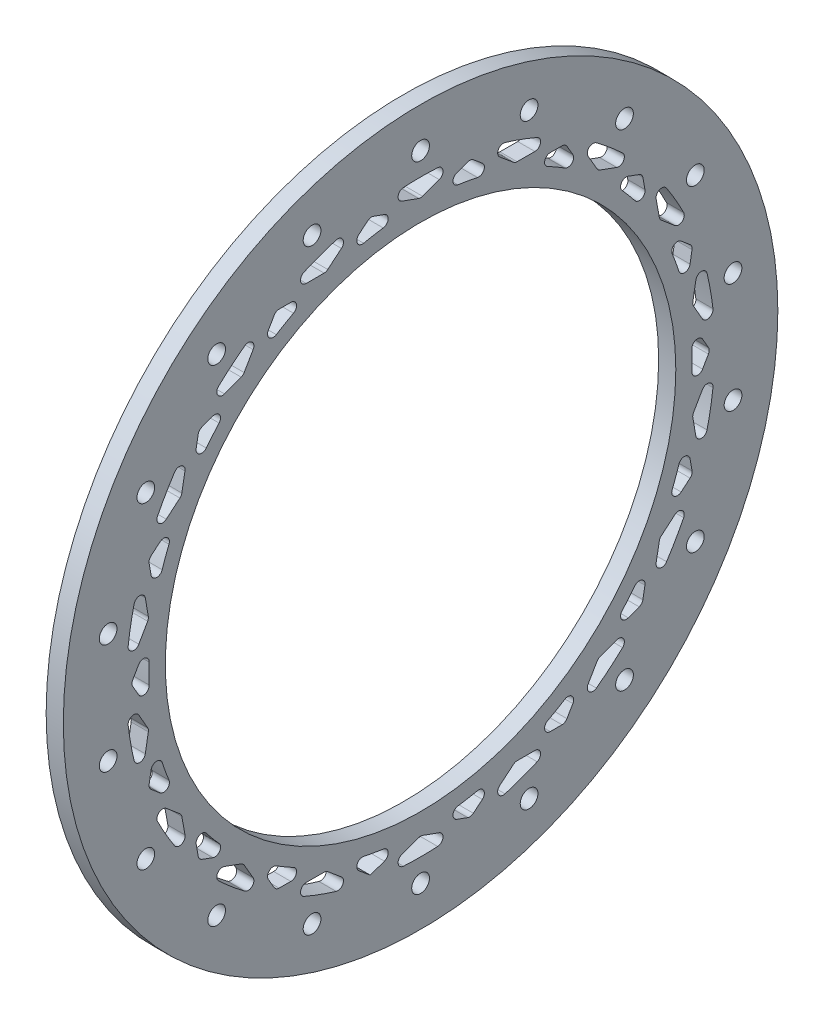
from build123d import *

# Parameters (mm, degrees)
SKETCH_1_R               = 62.5
SKETCH_1_R_2             = 44.65
EXTRUDE_1_DEPTH          = 3
SKETCH_2_R               = 1.55
CUT_EXTRUDE_1_DEPTH      = 89.439244682
PATTERN_CIRCULAR_1_COUNT = 18
SKETCH_3_R               = 51.5
SKETCH_3_R_2             = 47.5
CUT_EXTRUDE_2_DEPTH      = 89.439244682
EXTRUDE_4_DEPTH          = 3
FILLET_1_R               = 1


with BuildPart() as part:
    # 草图1 → 凸台-拉伸1 (new body)
    with BuildSketch(Plane(origin=(0, 0, 0), x_dir=(0, 0, -1), z_dir=(1, 0, 0))):
        Circle(SKETCH_1_R)
        Circle(SKETCH_1_R_2, mode=Mode.SUBTRACT)
    extrude(amount=EXTRUDE_1_DEPTH)

    # 草图2 → 切除-拉伸1 (cut, through all)
    with BuildSketch(Plane(origin=(3, 0, 0), x_dir=(0, 0, -1), z_dir=(1, 0, 0))):
        with Locations((0, 55.5)):
            Circle(SKETCH_2_R)
    cut_extrude_1 = extrude(amount=-CUT_EXTRUDE_1_DEPTH, mode=Mode.SUBTRACT)

    # 阵列(圆周)1: 切除-拉伸1 ×18 about axis
    pattern_circular_1_axis = Axis((0, 0, 0), (1, 0, 0))
    for i in range(1, PATTERN_CIRCULAR_1_COUNT):
        add(cut_extrude_1.rotate(pattern_circular_1_axis, i * 360 / PATTERN_CIRCULAR_1_COUNT), mode=Mode.SUBTRACT)

    # 草图3 → 切除-拉伸2 (cut, through all)
    with BuildSketch(Plane(origin=(3, 0, 0), x_dir=(0, 0, -1), z_dir=(1, 0, 0))):
        Circle(SKETCH_3_R)
        Circle(SKETCH_3_R_2, mode=Mode.SUBTRACT)
    extrude(amount=-CUT_EXTRUDE_2_DEPTH, mode=Mode.SUBTRACT)


with BuildPart() as cut_extrude_2_piece_1:
    # of the separate pieces the step leaves, piece 1, a body of its own (cut_extrude_2_pieces)
    add(part.part.solids().sort_by_distance((0, 0, -62.5))[0])



with BuildPart() as cut_extrude_2_piece_2:
    # of the separate pieces the step leaves, piece 2, a body of its own (cut_extrude_2_pieces)
    add(part.part.solids().sort_by_distance((0, 0, -47.5))[0])


with BuildPart() as cut_extrude_2_piece_1_1:
    add(cut_extrude_2_piece_1.part)

    add(cut_extrude_2_piece_2.part)  # 拉伸-薄壁4 merges 切除-拉伸2 piece 2
    # 草图4 → 拉伸-薄壁4 (add, through all)
    with BuildSketch(Plane(origin=(3, 0, 0), x_dir=(0, 0, -1), z_dir=(1, 0, 0))):
        Polygon((-9.092946013, 51.568659408), (0, 48.297067619), (9.092946013, 51.568659408), (16.518569989, 45.384398047), (26.182094551, 45.348718011), (31.044756649, 36.997700268), (40.11329608, 33.659051946), (41.826487486, 24.148533809), (49.206242093, 17.909607462), (47.563326638, 8.386697779), (52.364189102, 0), (47.563326638, -8.386697779), (49.206242093, -17.909607462), (41.826487486, -24.148533809), (40.11329608, -33.659051946), (31.044756649, -36.997700268), (26.182094551, -45.348718011), (16.518569989, -45.384398047), (9.092946013, -51.568659408), (0, -48.297067619), (-9.092946013, -51.568659408), (-16.518569989, -45.384398047), (-26.182094551, -45.348718011), (-31.044756649, -36.997700268), (-40.11329608, -33.659051946), (-41.826487486, -24.148533809), (-49.206242093, -17.909607462), (-47.563326638, -8.386697779), (-52.364189102, 0), (-47.563326638, 8.386697779), (-49.206242093, 17.909607462), (-41.826487486, 24.148533809), (-40.11329608, 33.659051946), (-31.044756649, 36.997700268), (-26.182094551, 45.348718011), (-16.518569989, 45.384398047), align=None)
        Polygon((-8.792816287, 49.866539152), (0, 46.702932381), (8.792816287, 49.866539152), (15.973343627, 43.886400928), (25.317905449, 43.851898579), (30.020066271, 35.776521828), (38.789281561, 32.548071852), (40.445925874, 23.351466191), (47.582097848, 17.318467301), (45.993409898, 8.1098791), (50.635810898, 0), (45.993409898, -8.1098791), (47.582097848, -17.318467301), (40.445925874, -23.351466191), (38.789281561, -32.548071852), (30.020066271, -35.776521828), (25.317905449, -43.851898579), (15.973343627, -43.886400928), (8.792816287, -49.866539152), (0, -46.702932381), (-8.792816287, -49.866539152), (-15.973343627, -43.886400928), (-25.317905449, -43.851898579), (-30.020066271, -35.776521828), (-38.789281561, -32.548071852), (-40.445925874, -23.351466191), (-47.582097848, -17.318467301), (-45.993409898, -8.1098791), (-50.635810898, 0), (-45.993409898, 8.1098791), (-47.582097848, 17.318467301), (-40.445925874, 23.351466191), (-38.789281561, 32.548071852), (-30.020066271, 35.776521828), (-25.317905449, 43.851898579), (-15.973343627, 43.886400928), align=None, mode=Mode.SUBTRACT)
    extrude(amount=-EXTRUDE_4_DEPTH)

    # 圆角1
    fillet_1_edges = [cut_extrude_2_piece_1_1.edges().sort_by_distance(p)[0] for p in [
        (1.5, 48.297067619, 0),
        (1.5, 45.384398047, -16.518569989),
        (1.5, 36.997700268, -31.044756649),
        (1.5, 24.148533809, -41.826487486),
        (1.5, 8.386697779, -47.563326638),
        (1.5, -8.386697779, -47.563326638),
        (1.5, -24.148533809, -41.826487486),
        (1.5, -36.997700268, -31.044756649),
        (1.5, -45.384398047, -16.518569989),
        (1.5, -48.297067619, 0),
        (1.5, -45.384398047, 16.518569989),
        (1.5, -36.997700268, 31.044756649),
        (1.5, -24.148533809, 41.826487486),
        (1.5, -8.386697779, 47.563326638),
        (1.5, 8.386697779, 47.563326638),
        (1.5, 24.148533809, 41.826487486),
        (1.5, 36.997700268, 31.044756649),
        (1.5, 45.384398047, 16.518569989),
        (1.5, 49.866539152, -8.792816287),
        (1.5, 43.851898579, -25.317905449),
        (1.5, 32.548071852, -38.789281561),
        (1.5, 17.318467301, -47.582097848),
        (1.5, 0, -50.635810898),
        (1.5, -17.318467301, -47.582097848),
        (1.5, -32.548071852, -38.789281561),
        (1.5, -43.851898579, -25.317905449),
        (1.5, -49.866539152, -8.792816287),
        (1.5, -43.851898579, 25.317905449),
        (1.5, -32.548071852, 38.789281561),
        (1.5, -17.318467301, 47.582097848),
        (1.5, 0, 50.635810898),
        (1.5, 17.318467301, 47.582097848),
        (1.5, 32.548071852, 38.789281561),
        (1.5, 43.851898579, 25.317905449),
        (1.5, 49.866539152, 8.792816287),
        (1.5, 45.306319687, 14.268405533),
        (1.5, 47.45409639, 2.087758564),
        (1.5, 47.45409639, -2.087758564),
        (1.5, 45.306319687, -14.268405533),
        (1.5, 43.878208721, -18.192108165),
        (1.5, 37.693932179, -28.903589342),
        (1.5, 35.009961506, -32.102221034),
        (1.5, 25.535100148, -40.052573706),
        (1.5, 21.918996242, -42.140332269),
        (1.5, 10.296358181, -46.370626567),
        (1.5, 6.184276541, -47.095697507),
        (1.5, -6.184276541, -47.095697507),
        (1.5, -10.296358181, -46.370626567),
        (1.5, -21.918996242, -42.140332269),
        (1.5, -25.535100148, -40.052573706),
        (1.5, -35.009961506, -32.102221034),
        (1.5, -37.693932179, -28.903589342),
        (1.5, -43.878208721, -18.192108165),
        (1.5, -45.306319687, -14.268405533),
        (1.5, -47.45409639, -2.087758564),
        (1.5, -47.45409639, 2.087758564),
        (1.5, -45.306319687, 14.268405533),
        (1.5, -43.878208721, 18.192108165),
        (1.5, -37.693932179, 28.903589342),
        (1.5, -35.009961506, 32.102221034),
        (1.5, -25.535100148, 40.052573706),
        (1.5, -21.918996242, 42.140332269),
        (1.5, -10.296358181, 46.370626567),
        (1.5, -6.184276541, 47.095697507),
        (1.5, 6.184276541, 47.095697507),
        (1.5, 10.296358181, 46.370626567),
        (1.5, 21.918996242, 42.140332269),
        (1.5, 25.535100148, 40.052573706),
        (1.5, 35.009961506, 32.102221034),
        (1.5, 37.693932179, 28.903589342),
        (1.5, 43.878208721, 18.192108165),
        (1.5, 50.425378135, 10.465717365),
        (1.5, 45.355314161, 24.395603648),
        (1.5, 43.80486958, 27.081052436),
        (1.5, 34.276266175, 38.436799777),
        (1.5, 31.900847263, 40.43001291),
        (1.5, 19.062994624, 47.841950587),
        (1.5, 16.14911196, 48.902517143),
        (1.5, 1.550444581, 51.476656084),
        (1.5, -1.550444581, 51.476656084),
        (1.5, -16.14911196, 48.902517143),
        (1.5, -19.062994624, 47.841950587),
        (1.5, -31.900847263, 40.43001291),
        (1.5, -34.276266175, 38.436799777),
        (1.5, -43.80486958, 27.081052436),
        (1.5, -45.355314161, 24.395603648),
        (1.5, -50.425378135, 10.465717365),
        (1.5, -50.963841887, 7.411937677),
        (1.5, -50.963841887, -7.411937677),
        (1.5, -50.425378135, -10.465717365),
        (1.5, -45.355314161, -24.395603648),
        (1.5, -43.80486958, -27.081052436),
        (1.5, -34.276266175, -38.436799777),
        (1.5, -31.900847263, -40.43001291),
        (1.5, -19.062994624, -47.841950587),
        (1.5, -16.14911196, -48.902517143),
        (1.5, -1.550444581, -51.476656084),
        (1.5, 1.550444581, -51.476656084),
        (1.5, 16.14911196, -48.902517143),
        (1.5, 19.062994624, -47.841950587),
        (1.5, 31.900847263, -40.43001291),
        (1.5, 34.276266175, -38.436799777),
        (1.5, 43.80486958, -27.081052436),
        (1.5, 45.355314161, -24.395603648),
        (1.5, 50.425378135, -10.465717365),
        (1.5, 50.963841887, -7.411937677),
        (1.5, 50.963841887, 7.411937677),
    ]]
    fillet(fillet_1_edges, radius=FILLET_1_R)


solid = cut_extrude_2_piece_1_1.part
